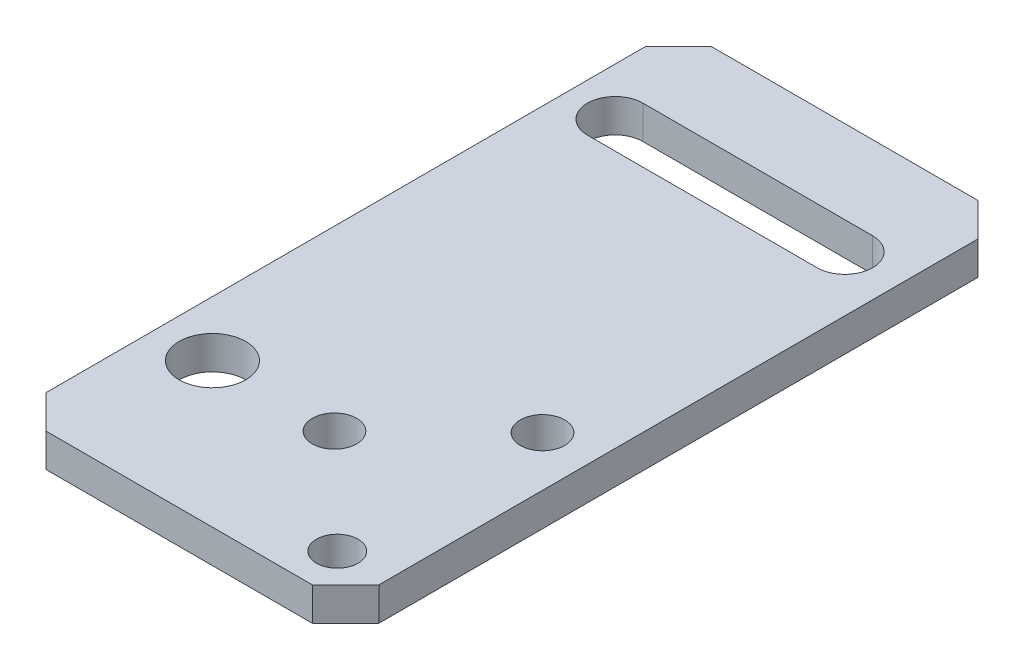
from build123d import *

# Parameters (mm, degrees)
CROQUIS1_W              = 30
CROQUIS1_H              = 60
CROQUIS1_R              = 3
CROQUIS1_R_2            = 2
CROQUIS1_R_3            = 1.878445215
SALIENTE_EXTRUIR1_DEPTH = 3
CHAFL_N1_SIZE           = 3


with BuildPart() as part:
    # Croquis1 → Saliente-Extruir1 (new body)
    with BuildSketch(Plane(origin=(0, 0, 0), x_dir=(1, 0, 0), z_dir=(0, 1, 0))):
        Rectangle(CROQUIS1_W, CROQUIS1_H)
        with Locations(Location((-10, -17, 0), (0, 0, 270))):
            Circle(CROQUIS1_R, mode=Mode.SUBTRACT)
        with Locations(Location((1, -17, 0), (0, 0, 270))):
            Circle(CROQUIS1_R_2, mode=Mode.SUBTRACT)
        with Locations(Location((10.5, -7.75, 0), (0, 0, 270))):
            Circle(CROQUIS1_R_2, mode=Mode.SUBTRACT)
        with Locations(Location((10.5, -26.25, 0), (0, 0, 270))):
            Circle(CROQUIS1_R_3, mode=Mode.SUBTRACT)
        with BuildLine():
            Line((-10.7, 17.5), (10, 17.5))
            ThreePointArc((10, 17.5), (12.5, 20), (10, 22.5))
            Line((10, 22.5), (-10.7, 22.5))
            ThreePointArc((-10.7, 22.5), (-13.2, 20), (-10.7, 17.5))
        make_face(mode=Mode.SUBTRACT)
    extrude(amount=SALIENTE_EXTRUIR1_DEPTH)

    # Chaflán1
    chafl_n1_edges = [part.edges().sort_by_distance(p)[0] for p in [
        (15, 1.5, 30),
        (-15, 1.5, 30),
        (-15, 1.5, -30),
        (15, 1.5, -30),
    ]]
    chamfer(chafl_n1_edges, length=CHAFL_N1_SIZE)


solid = part.part
